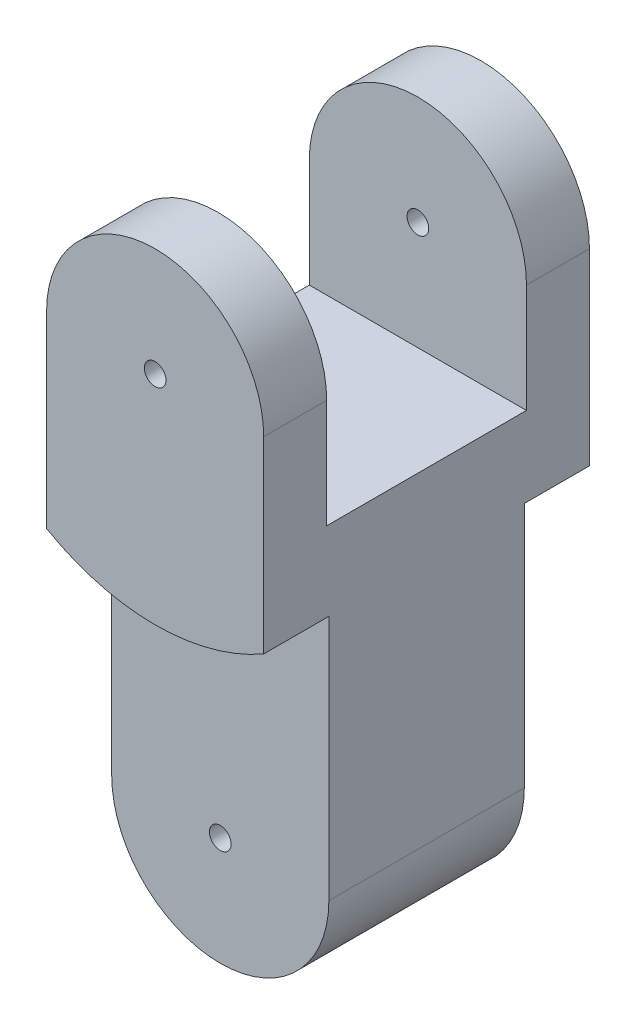
from build123d import *

# Parameters (mm, degrees)
SKIZZE1_R                       = 5
AUFSATZ_LINEAR_AUSTRAGEN1_DEPTH = 90
SKIZZE2_R                       = 5
AUFSATZ_LINEAR_AUSTRAGEN2_DEPTH = 30
SKIZZE3_W                       = 92
SKIZZE3_H                       = 100
SCHNITT_LINEAR_AUSTRAGEN1_DEPTH = 295.78805946


with BuildPart() as part:
    # Skizze1 → Aufsatz-Linear austragen1 (new body)
    with BuildSketch(Plane.XY):
        with BuildLine():
            Line((50, 0), (50, 200))
            ThreePointArc((50, 200), (0, 250), (-50, 200))
            Line((-50, 200), (-50, 0))
            ThreePointArc((-50, 0), (0, -50), (50, 0))
        make_face()
        with Locations(Location((0, 200, 0), (0, 0, 180))):
            Circle(SKIZZE1_R, mode=Mode.SUBTRACT)
        with Locations(Location((0, 0, 0), (0, 0, 180))):
            Circle(SKIZZE1_R, mode=Mode.SUBTRACT)
    extrude(amount=AUFSATZ_LINEAR_AUSTRAGEN1_DEPTH)

    # Skizze2 → Aufsatz-Linear austragen2 (add)
    # profile 1 of 2: a face of its own
    with BuildSketch(Plane.XY.offset(90)):
        with BuildLine():
            ThreePointArc((50, 200), (0, 250), (-50, 200))
            ThreePointArc((-50, 200), (0, 150), (50, 200))
        make_face()
        with Locations(Location((0, 200, 0), (0, 0, 180))):
            Circle(SKIZZE2_R, mode=Mode.SUBTRACT)
    # profile 2 of 2: a face of its own
    with BuildSketch(Plane.XY.offset(90)):
        with BuildLine():
            ThreePointArc((50, 200), (0, 150), (-50, 200))
            Line((-50, 200), (-50, 113.397459622))
            ThreePointArc((-50, 113.397459622), (0, 100), (50, 113.397459622))
            Line((50, 113.397459622), (50, 200))
        make_face()
    aufsatz_linear_austragen2 = extrude(amount=AUFSATZ_LINEAR_AUSTRAGEN2_DEPTH)

    # Spiegeln1: Aufsatz-Linear austragen2 across plane
    add(aufsatz_linear_austragen2.mirror(Plane(origin=(0, 0, 45), x_dir=(1, 0, 0), z_dir=(0, 0, -1))))

    # Skizze3 → Schnitt-Linear austragen1 (cut, through all)
    with BuildSketch(Plane.ZY.offset(50)):
        with Locations((45, 200)):
            Rectangle(SKIZZE3_W, SKIZZE3_H)
    extrude(amount=-SCHNITT_LINEAR_AUSTRAGEN1_DEPTH, mode=Mode.SUBTRACT)


solid = part.part
